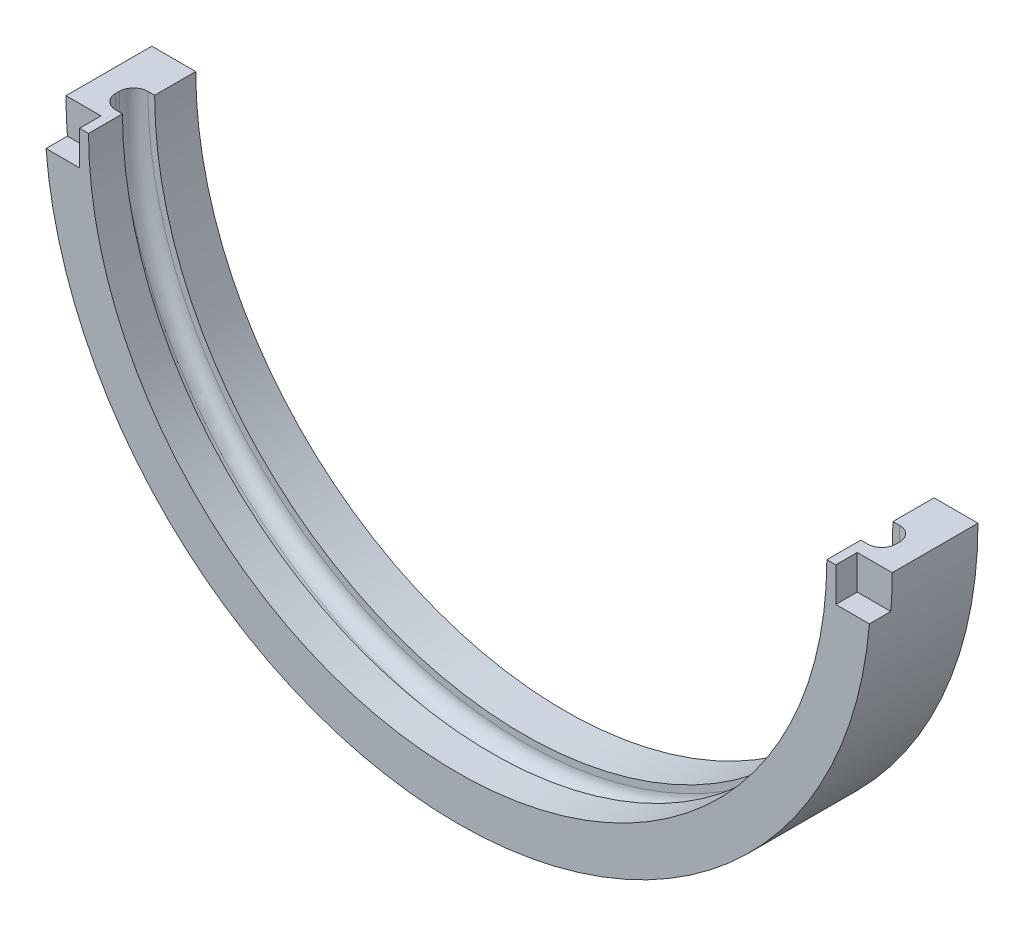
from build123d import *

# Parameters (mm, degrees)
BOSS_EXTRUDE1_DEPTH = 5.715
BOSS_EXTRUDE2_DEPTH = 6.0325
BOSS_EXTRUDE3_START = 7.3025
BOSS_EXTRUDE3_DEPTH = 7.3025
FILLET1_R           = 2.54
SKETCH6_W           = 6.645493415
SKETCH6_H           = 6.096
CUT_EXTRUDE5_DEPTH  = 3.81


with BuildPart() as part:
    # Sketch1 → Boss-Extrude1 (new body)
    with BuildSketch(Plane.XY):
        with BuildLine():
            ThreePointArc((69.342, 73.406), (0, 4.064), (-69.342, 73.406))
            Line((-69.342, 73.406), (-73.406, 73.406))
            ThreePointArc((-73.406, 73.406), (0, 0), (73.406, 73.406))
            Line((73.406, 73.406), (69.342, 73.406))
        make_face()
    extrude(amount=BOSS_EXTRUDE1_DEPTH)

    # Sketch3 → Boss-Extrude2 (add)
    with BuildSketch(Plane.XY.offset(5.715)):
        with BuildLine():
            ThreePointArc((65.5955, 73.406), (0, 7.8105), (-65.5955, 73.406))
            Line((-65.5955, 73.406), (-69.342, 73.406))
            ThreePointArc((-69.342, 73.406), (0, 4.064), (69.342, 73.406))
            Line((69.342, 73.406), (65.5955, 73.406))
        make_face()
        with BuildLine():
            Line((73.406, 73.406), (69.342, 73.406))
            ThreePointArc((69.342, 73.406), (0, 4.064), (-69.342, 73.406))
            Line((-69.342, 73.406), (-73.406, 73.406))
            ThreePointArc((-73.406, 73.406), (0, 0), (73.406, 73.406))
        make_face()
    extrude(amount=BOSS_EXTRUDE2_DEPTH)

    # Sketch4 → Boss-Extrude3 (add)
    with BuildSketch(Plane(origin=(0, 0, 0), x_dir=(-1, 0, 0), z_dir=(0, 0, -1)).offset(BOSS_EXTRUDE3_START)):
        with BuildLine():
            ThreePointArc((65.5955, 73.406), (0, 7.8105), (-65.5955, 73.406))
            Line((-65.5955, 73.406), (-69.342, 73.406))
            ThreePointArc((-69.342, 73.406), (0, 4.064), (69.342, 73.406))
            Line((69.342, 73.406), (65.5955, 73.406))
        make_face()
        with BuildLine():
            Line((73.406, 73.406), (69.342, 73.406))
            ThreePointArc((69.342, 73.406), (0, 4.064), (-69.342, 73.406))
            Line((-69.342, 73.406), (-73.406, 73.406))
            ThreePointArc((-73.406, 73.406), (0, 0), (73.406, 73.406))
        make_face()
    extrude(amount=-BOSS_EXTRUDE3_DEPTH)

    # Fillet1
    fillet1_edges = [part.edges().sort_by_distance(p)[0] for p in [
        (0, 4.064, 5.715),
        (0, 4.064, 0),
    ]]
    fillet(fillet1_edges, radius=FILLET1_R)

    # Sketch6 → Cut-Extrude5 (cut)
    with BuildSketch(Plane.XY.offset(11.7475)):
        with Locations((-70.506627119, 70.358)):
            Rectangle(SKETCH6_W, SKETCH6_H)
        with Locations((70.506627119, 70.358)):
            Rectangle(SKETCH6_W, SKETCH6_H)
    extrude(amount=-CUT_EXTRUDE5_DEPTH, mode=Mode.SUBTRACT)


solid = part.part
